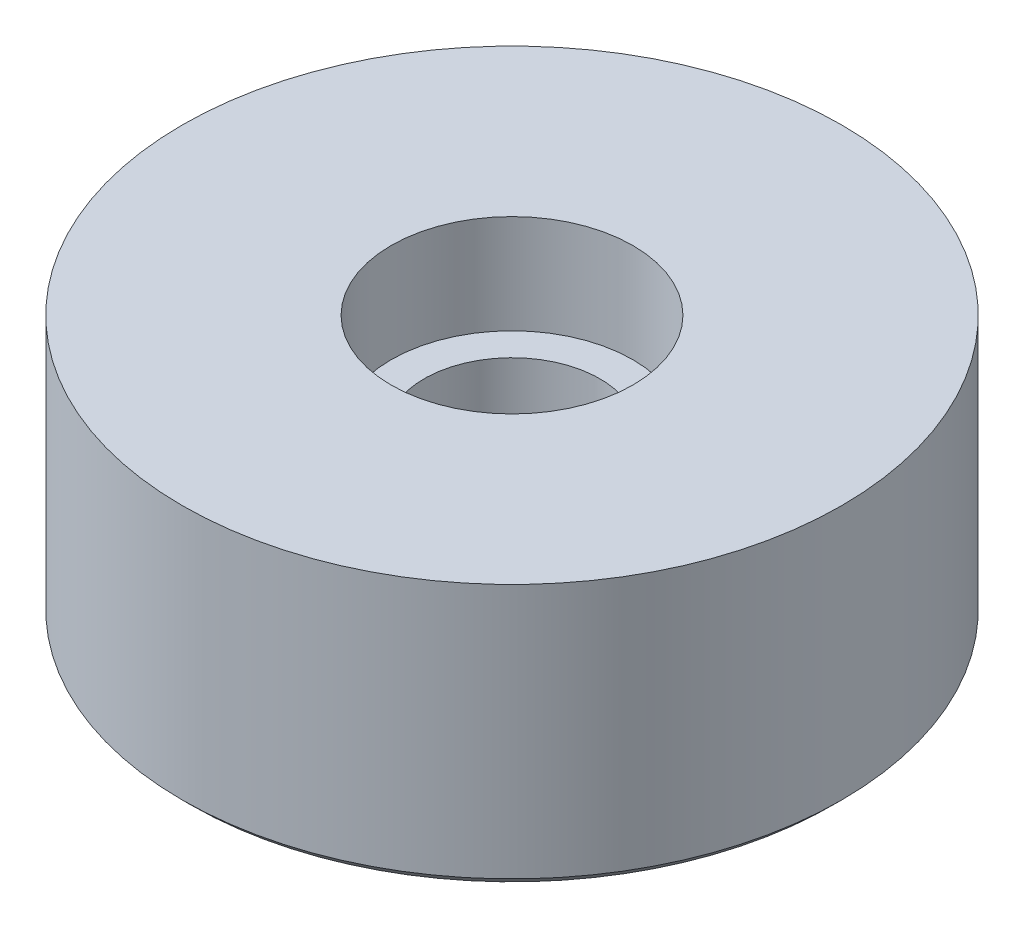
from build123d import *

# Parameters (mm, degrees)
SKETCH1_R           = 15
SKETCH1_R_2         = 4
BOSS_EXTRUDE1_DEPTH = 12
SKETCH2_R           = 5.5
CUT_EXTRUDE1_DEPTH  = 4.5
CHAMFER1_SIZE       = 0.4
CHAMFER1_SIZE2      = 0.399999869


with BuildPart() as part:
    # Sketch1 → Boss-Extrude1 (new body)
    with BuildSketch(Plane(origin=(0, 0, 0), x_dir=(1, 0, 0), z_dir=(0, 1, 0))):
        with Locations(Location((0, 0, 0), (0, 0, 270))):
            Circle(SKETCH1_R)
        with Locations(Location((0, 0, 0), (0, 0, 270))):
            Circle(SKETCH1_R_2, mode=Mode.SUBTRACT)
    extrude(amount=BOSS_EXTRUDE1_DEPTH)

    # Sketch2 → Cut-Extrude1 (cut, symmetric)
    with BuildSketch(Plane(origin=(0, 12, 0), x_dir=(1, 0, 0), z_dir=(0, 1, 0))):
        with Locations(Location((0, 0, 0), (0, 0, 270))):
            Circle(SKETCH2_R)
    extrude(amount=CUT_EXTRUDE1_DEPTH, both=True, mode=Mode.SUBTRACT)

    # Chamfer1
    chamfer1_edges = [part.edges().sort_by_distance(p)[0] for p in [
        (0, 0, -15),
    ]]
    chamfer1_side = [part.faces().sort_by_distance(p)[0] for p in [
        (0, 6, -15),
    ]]
    chamfer(chamfer1_edges, length=CHAMFER1_SIZE, length2=CHAMFER1_SIZE2, reference=chamfer1_side[0])


solid = part.part
